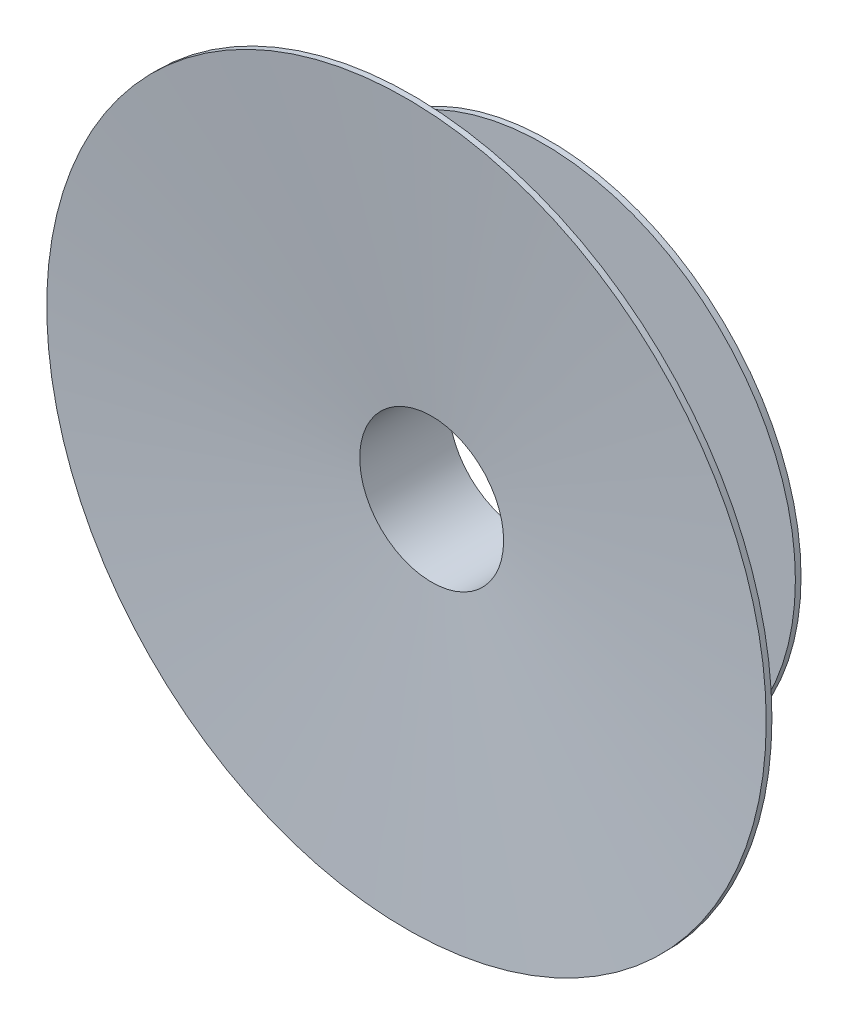
from build123d import *


with BuildPart() as part:
    # Sketch1 → Revolve1 (revolve)
    with BuildSketch(Plane.YZ, mode=Mode.PRIVATE) as revolve1_sk:
        with BuildLine():
            ThreePointArc((-57.15, -39.5), (-43.428307314, -36.322800112), (-31.106422396, -29.5))
            Line((-31.106422396, -29.5), (-25.4, -29.5))
            Line((-25.4, -29.5), (-25.4, 2))
            Line((-25.4, 2), (-127, 10.888848214))
            Line((-127, 10.888848214), (-127, 8.881208539))
            Line((-127, 8.881208539), (-27.4, 0.167337652))
            Line((-27.4, 0.167337652), (-27.4, -23.683734158))
            ThreePointArc((-27.4, -23.683734158), (-41.079585236, -33.165904784), (-57.15, -37.5))
            Line((-57.15, -37.5), (-88.9, -37.5))
            Line((-88.9, -37.5), (-88.9, -39.5))
            Line((-88.9, -39.5), (-57.15, -39.5))
        make_face()
    revolve(revolve1_sk.sketch.rotate(Axis((0, 0, 14.051954895), (0, 0, -1)), 270), axis=Axis((0, 0, 14.051954895), (0, 0, -1)))


solid = part.part
